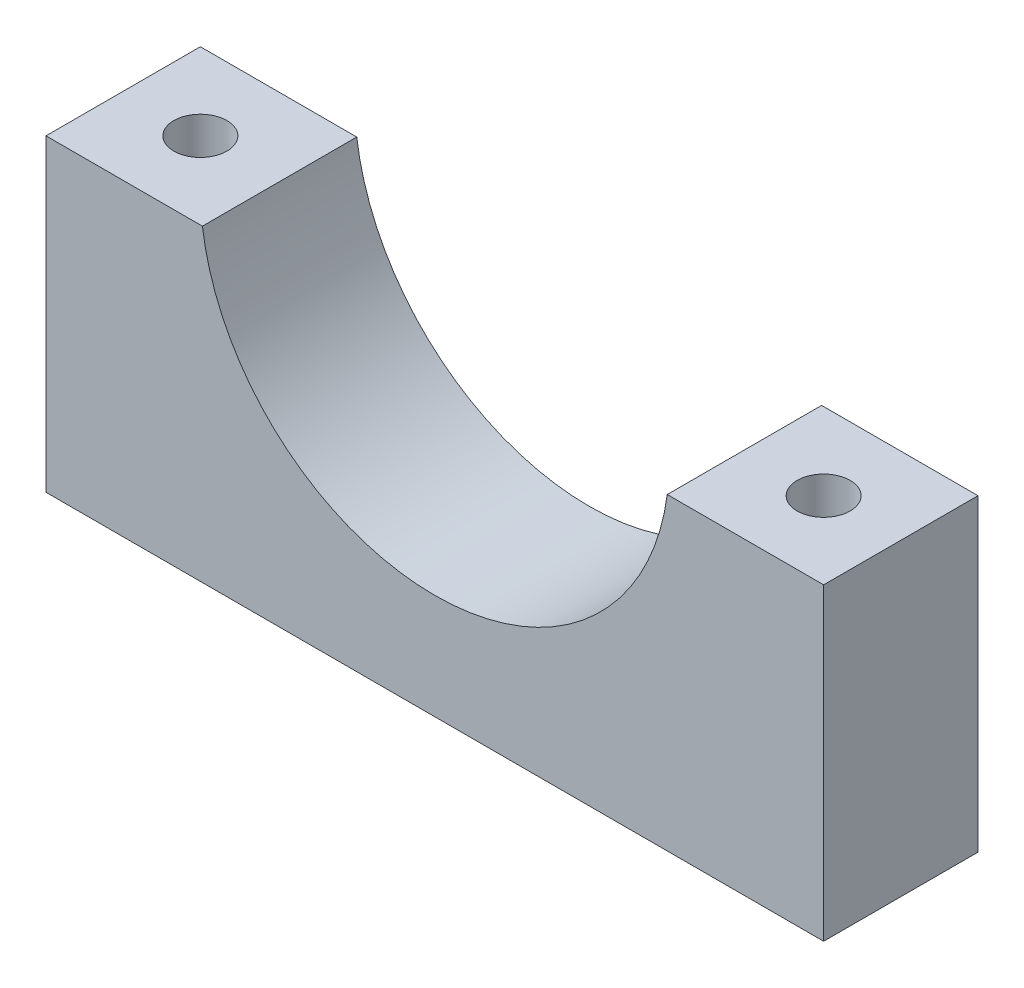
from build123d import *

# Parameters (mm, degrees)
BOSS_EXTRUDE1_DEPTH = 12.7
SKETCH2_R           = 2.1828125
CUT_EXTRUDE1_DEPTH  = 43.777251848


with BuildPart() as part:
    # Sketch1 → Boss-Extrude1 (new body)
    with BuildSketch(Plane.XY):
        with BuildLine():
            Line((-19.123353673, -2.54), (-31.9913, -2.54))
            Line((-31.9913, -2.54), (-31.9913, -27.94))
            Line((-31.9913, -27.94), (31.9913, -27.94))
            Line((31.9913, -27.94), (31.9913, -2.54))
            Line((31.9913, -2.54), (19.123353673, -2.54))
            ThreePointArc((19.123353673, -2.54), (0, -19.2913), (-19.123353673, -2.54))
        make_face()
    extrude(amount=BOSS_EXTRUDE1_DEPTH)

    # Sketch2 → Cut-Extrude1 (cut, through all)
    with BuildSketch(Plane.XZ.offset(27.94)):
        with Locations((-25.6413, 6.35)):
            Circle(SKETCH2_R)
        with Locations((25.6413, 6.35)):
            Circle(SKETCH2_R)
    extrude(amount=-CUT_EXTRUDE1_DEPTH, mode=Mode.SUBTRACT)


solid = part.part
